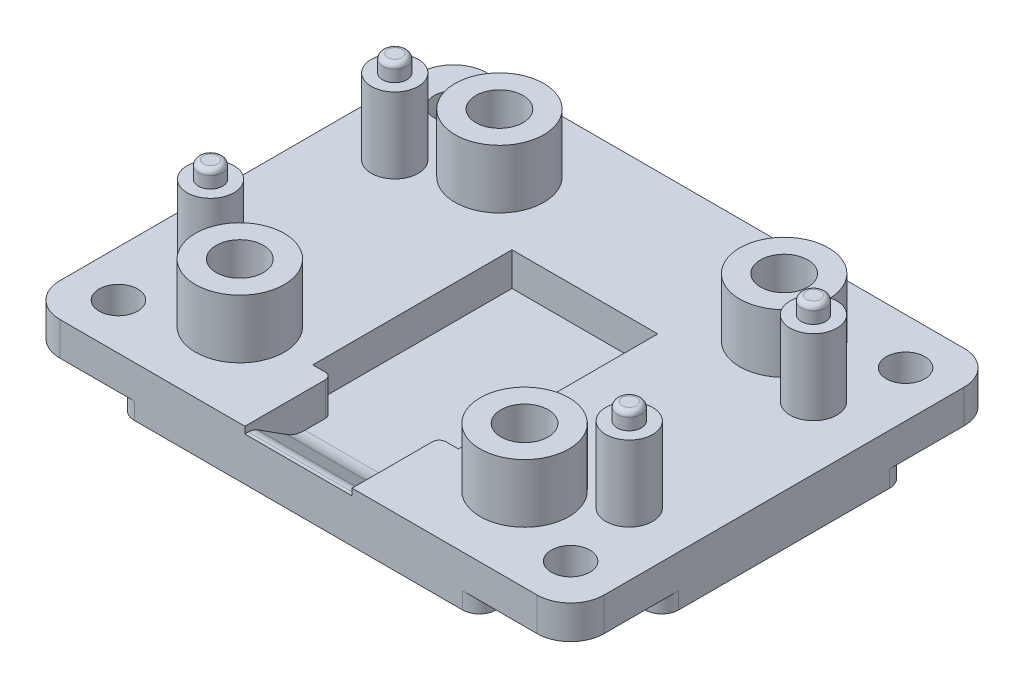
from build123d import *

# Parameters (mm, degrees)
SKETCH_1_W           = 32.5
SKETCH_1_H           = 25.5
EXTRUDE_1_DEPTH      = 3
EXTRUDE_2_DEPTH      = 1.5
SKETCH_5_R           = 1.4
EXTRUDE_3_DEPTH      = 4.5
SKETCH_6_R           = 0.725
EXTRUDE_4_DEPTH      = 1
SKETCH_7_R           = 1
CUT_EXTRUDE_1_DEPTH  = 10
SKETCH_8_R           = 2
CUT_EXTRUDE_2_DEPTH  = 1
FILLET_1_R           = 2
SKETCH_9_R           = 2.65
EXTRUDE_5_DEPTH      = 3.5
SKETCH_11_R          = 1.05
CUT_EXTRUDE_4_DEPTH  = 100
SKETCH_12_R          = 1.41
CUT_EXTRUDE_5_DEPTH  = 5.5
FILLET_2_R           = 0.3
CUT_EXTRUDE_8_DEPTH  = 2
CUT_EXTRUDE_9_DEPTH  = 1.5
EXTRUDE_6_DEPTH      = 6.4
FILLET_3_R           = 2
FILLET_5_R           = 1
FILLET_6_R           = 0.4
CUT_EXTRUDE_13_DEPTH = 1
FILLET_7_R           = 1
SKETCH_22_R          = 1.15
CUT_EXTRUDE_14_DEPTH = 10


with BuildPart() as part:
    # 草图1 → 凸台-拉伸1 (new body)
    with BuildSketch(Plane(origin=(0, 0, 0), x_dir=(1, 0, 0), z_dir=(0, 1, 0))):
        Rectangle(SKETCH_1_W, SKETCH_1_H)
    extrude(amount=EXTRUDE_1_DEPTH)

    # 草图2 → 凸台-拉伸2 (add)
    with BuildSketch(Plane(origin=(0, 3, 0), x_dir=(1, 0, 0), z_dir=(0, 1, 0))):
        Polygon((-5.35, 5.35), (5.35, 5.35), (5.35, -7.55), (4.35, -7.55), (4.35, 4.35), (-4.35, 4.35), (-4.35, -7.55), (-5.35, -7.55), align=None)
    extrude(amount=EXTRUDE_2_DEPTH)

    # 草图5 → 凸台-拉伸3 (add)
    with BuildSketch(Plane(origin=(0, 3, 0), x_dir=(1, 0, 0), z_dir=(0, 1, 0))):
        with Locations(Location((12.5, 5.5, 0), (0, 0, 270))):
            Circle(SKETCH_5_R)
        with Locations(Location((12.5, -5.5, 0), (0, 0, 90))):
            Circle(SKETCH_5_R)
        with Locations(Location((-12.5, -5.5, 0), (0, 0, 270))):
            Circle(SKETCH_5_R)
        with Locations(Location((-12.5, 5.5, 0), (0, 0, 90))):
            Circle(SKETCH_5_R)
    extrude(amount=EXTRUDE_3_DEPTH)

    # 草图6 → 凸台-拉伸4 (add)
    with BuildSketch(Plane(origin=(0, 7.5, 0), x_dir=(1, 0, 0), z_dir=(0, 1, 0))):
        with Locations(Location((-12.5, -5.5, 0), (0, 0, 270))):
            Circle(SKETCH_6_R)
        with Locations(Location((-12.5, 5.5, 0), (0, 0, 270))):
            Circle(SKETCH_6_R)
        with Locations(Location((12.5, 5.5, 0), (0, 0, 270))):
            Circle(SKETCH_6_R)
        with Locations(Location((12.5, -5.5, 0), (0, 0, 270))):
            Circle(SKETCH_6_R)
    extrude(amount=EXTRUDE_4_DEPTH)

    # 草图7 → 切除-拉伸1 (cut)
    with BuildSketch(Plane(origin=(0, 3, 0), x_dir=(1, 0, 0), z_dir=(0, 1, 0))):
        with Locations(Location((13.5, 10, 0), (0, 0, 270))):
            Circle(SKETCH_7_R)
        with Locations(Location((-13.5, 10, 0), (0, 0, 270))):
            Circle(SKETCH_7_R)
        with Locations(Location((-13.5, -10, 0), (0, 0, 270))):
            Circle(SKETCH_7_R)
        with Locations(Location((13.5, -10, 0), (0, 0, 270))):
            Circle(SKETCH_7_R)
    extrude(amount=-CUT_EXTRUDE_1_DEPTH, mode=Mode.SUBTRACT)

    # 草图8 → 切除-拉伸2 (cut)
    with BuildSketch(Plane.XZ):
        with Locations(Location((-13.5, 10, 0), (0, 0, 270))):
            Circle(SKETCH_8_R)
        with Locations(Location((13.5, 10, 0), (0, 0, 270))):
            Circle(SKETCH_8_R)
        with Locations(Location((13.5, -10, 0), (0, 0, 270))):
            Circle(SKETCH_8_R)
        with Locations(Location((-13.5, -10, 0), (0, 0, 270))):
            Circle(SKETCH_8_R)
    extrude(amount=-CUT_EXTRUDE_2_DEPTH, mode=Mode.SUBTRACT)

    # 圆角1
    fillet_1_edges = [part.edges().sort_by_distance(p)[0] for p in [
        (16.25, 1.5, 12.75),
        (-16.25, 1.5, 12.75),
        (-16.25, 1.5, -12.75),
        (16.25, 1.5, -12.75),
    ]]
    fillet(fillet_1_edges, radius=FILLET_1_R)

    # 草图9 → 凸台-拉伸5 (add)
    with BuildSketch(Plane(origin=(0, 3, 0), x_dir=(1, 0, 0), z_dir=(0, 1, 0))):
        with Locations(Location((8.5, 7.75, 0), (0, 0, 270))):
            Circle(SKETCH_9_R)
        with Locations(Location((-8.5, 7.75, 0), (0, 0, 90))):
            Circle(SKETCH_9_R)
        with Locations(Location((-8.5, -7.75, 0), (0, 0, 270))):
            Circle(SKETCH_9_R)
        with Locations(Location((8.5, -7.75, 0), (0, 0, 90))):
            Circle(SKETCH_9_R)
    extrude(amount=EXTRUDE_5_DEPTH)

    # 草图11 → 切除-拉伸4 (cut)
    with BuildSketch(Plane(origin=(0, 6.5, 0), x_dir=(1, 0, 0), z_dir=(0, 1, 0))):
        with Locations(Location((-8.5, 7.75, 0), (0, 0, 270))):
            Circle(SKETCH_11_R)
        with Locations(Location((-8.5, -7.75, 0), (0, 0, 270))):
            Circle(SKETCH_11_R)
        with Locations(Location((8.5, -7.75, 0), (0, 0, 270))):
            Circle(SKETCH_11_R)
        with Locations(Location((8.5, 7.75, 0), (0, 0, 270))):
            Circle(SKETCH_11_R)
    extrude(amount=-CUT_EXTRUDE_4_DEPTH, mode=Mode.SUBTRACT)

    # 草图12 → 切除-拉伸5 (cut)
    with BuildSketch(Plane(origin=(0, 6.5, 0), x_dir=(1, 0, 0), z_dir=(0, 1, 0))):
        with Locations(Location((-8.5, 7.75, 0), (0, 0, 270))):
            Circle(SKETCH_12_R)
        with Locations(Location((8.5, 7.75, 0), (0, 0, 270))):
            Circle(SKETCH_12_R)
        with Locations(Location((-8.5, -7.75, 0), (0, 0, 270))):
            Circle(SKETCH_12_R)
        with Locations(Location((8.5, -7.75, 0), (0, 0, 270))):
            Circle(SKETCH_12_R)
    extrude(amount=-CUT_EXTRUDE_5_DEPTH, mode=Mode.SUBTRACT)

    # 圆角2
    fillet_2_edges = [part.edges().sort_by_distance(p)[0] for p in [
        (-12.5, 8.5, 4.775),
        (-12.5, 8.5, -6.225),
        (12.5, 8.5, -6.225),
        (12.5, 8.5, 4.775),
    ]]
    fillet(fillet_2_edges, radius=FILLET_2_R)

    # 草图15 → 切除-拉伸8 (cut)
    with BuildSketch(Plane(origin=(0, 3, 0), x_dir=(1, 0, 0), z_dir=(0, 1, 0))):
        Polygon((-4.35, 4.35), (4.35, 4.35), (4.35, -7.55), (3.2, -7.55), (3.2, -12.75), (-3.2, -12.75), (-3.2, -7.55), (-4.35, -7.55), align=None)
    extrude(amount=-CUT_EXTRUDE_8_DEPTH, mode=Mode.SUBTRACT)

    # 草图17 → 切除-拉伸9 (cut)
    with BuildSketch(Plane(origin=(0, 4.5, 0), x_dir=(1, 0, 0), z_dir=(0, 1, 0))):
        Polygon((-4.35, -7.55), (-4.35, 4.35), (4.35, 4.35), (4.35, -7.55), (5.35, -7.55), (5.35, 5.35), (-5.35, 5.35), (-5.35, -7.55), align=None)
    extrude(amount=-CUT_EXTRUDE_9_DEPTH, mode=Mode.SUBTRACT)

    # 草图18 → 凸台-拉伸6 (add)
    with BuildSketch(Plane.ZY.offset(-3.2)):
        Polygon((12.75, 1), (9.75, 1), (12.25, 2.6), (12.75, 2.6), align=None)
    extrude(amount=EXTRUDE_6_DEPTH)

    # 圆角3
    fillet_3_edges = [part.edges().sort_by_distance(p)[0] for p in [
        (0, 1, 9.75),
    ]]
    fillet(fillet_3_edges, radius=FILLET_3_R)

    # 圆角5
    fillet_5_edges = [part.edges().sort_by_distance(p)[0] for p in [
        (0, 2.6, 12.25),
    ]]
    fillet(fillet_5_edges, radius=FILLET_5_R)

    # 圆角6
    fillet_6_edges = [part.edges().sort_by_distance(p)[0] for p in [
        (3.2, 2, 7.55),
        (-3.2, 2, 7.55),
    ]]
    fillet(fillet_6_edges, radius=FILLET_6_R)

    # 草图21 → 切除-拉伸13 (cut)
    with BuildSketch(Plane.XZ):
        Polygon((-13.5, -7.3), (-10.8, -7.3), (-10.8, -12.75), (-16.25, -12.75), (-16.25, -7.3), align=None)
        Polygon((16.25, -12.75), (16.25, -7.3), (13.5, -7.3), (10.8, -7.3), (10.8, -12.75), align=None)
        Polygon((16.25, 12.75), (16.25, 7.3), (13.5, 7.3), (10.8, 7.3), (10.8, 12.75), align=None)
        Polygon((-10.8, 12.75), (-16.25, 12.75), (-16.25, 7.3), (-13.5, 7.3), (-10.8, 7.3), align=None)
    extrude(amount=-CUT_EXTRUDE_13_DEPTH, mode=Mode.SUBTRACT)

    # 圆角7
    fillet_7_edges = [part.edges().sort_by_distance(p)[0] for p in [
        (-16.25, 0.5, 7.3),
        (-10.8, 0.5, 12.75),
        (-10.8, 0.5, 7.3),
        (10.8, 0.5, 12.75),
        (16.25, 0.5, 7.3),
        (10.8, 0.5, 7.3),
        (16.25, 0.5, -7.3),
        (10.8, 0.5, -12.75),
        (10.8, 0.5, -7.3),
        (-10.8, 0.5, -12.75),
        (-16.25, 0.5, -7.3),
        (-10.8, 0.5, -7.3),
    ]]
    fillet(fillet_7_edges, radius=FILLET_7_R)

    # 草图22 → 切除-拉伸14 (cut)
    with BuildSketch(Plane.XZ.offset(-1)):
        with Locations(Location((13.5, -10, 0), (0, 0, 270))):
            Circle(SKETCH_22_R)
        with Locations(Location((13.5, 10, 0), (0, 0, 270))):
            Circle(SKETCH_22_R)
        with Locations(Location((-13.5, 10, 0), (0, 0, 270))):
            Circle(SKETCH_22_R)
        with Locations(Location((-13.5, -10, 0), (0, 0, 270))):
            Circle(SKETCH_22_R)
    extrude(amount=-CUT_EXTRUDE_14_DEPTH, mode=Mode.SUBTRACT)


solid = part.part
